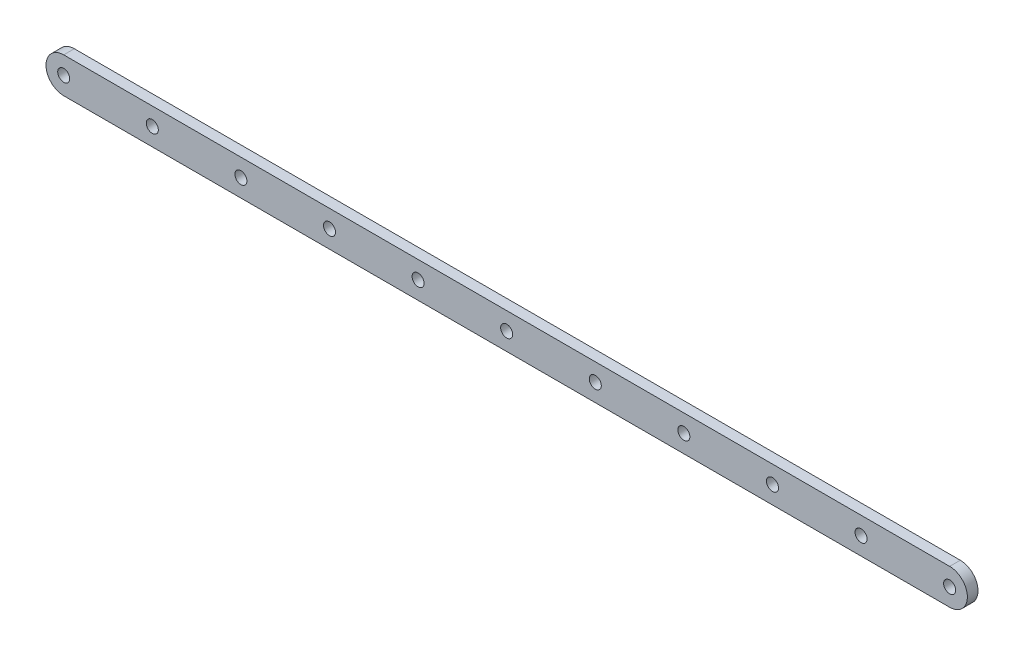
from build123d import *

# Parameters (mm, degrees)
SKETCH1_R           = 5
BOSS_EXTRUDE1_DEPTH = 3
SKETCH2_R           = 1.7
CUT_EXTRUDE1_DEPTH  = 256.066657954
LPATTERN1_COUNT     = 10
LPATTERN1_PITCH     = 25


with BuildPart() as part:
    # Sketch1 → Boss-Extrude1 (new body)
    with BuildSketch(Plane.XY):
        with BuildLine():
            Line((250, 5), (0, 5))
            ThreePointArc((0, 5), (3.535533906, 3.535533906), (5, 0))
            ThreePointArc((5, 0), (3.535533906, -3.535533906), (0, -5))
            Line((0, -5), (250, -5))
            ThreePointArc((250, -5), (245, 0), (250, 5))
        make_face()
        with Locations((250, 0)):
            Circle(SKETCH1_R)
        Circle(SKETCH1_R)
    extrude(amount=BOSS_EXTRUDE1_DEPTH)

    # Sketch2 → Cut-Extrude1 (cut, through all)
    with BuildSketch(Plane.XY.offset(3)):
        Circle(SKETCH2_R)
        with Locations((250, 0)):
            Circle(SKETCH2_R)
    cut_extrude1 = extrude(amount=-CUT_EXTRUDE1_DEPTH, mode=Mode.SUBTRACT)

    # LPattern1: Cut-Extrude1 ×10
    with Locations(*[(i * LPATTERN1_PITCH, 0, 0) for i in range(1, LPATTERN1_COUNT)]):
        add(cut_extrude1, mode=Mode.SUBTRACT)


solid = part.part
